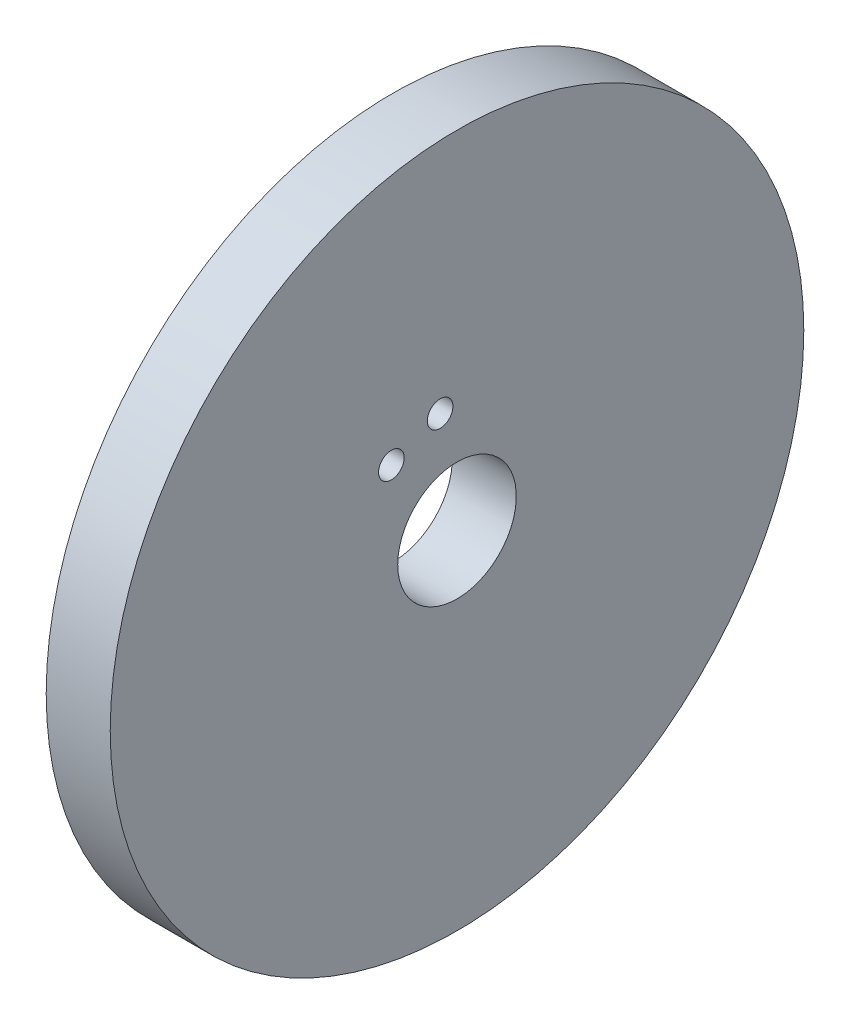
from build123d import *

# Parameters (mm, degrees)
AXIAL_PROFILE_MM_W     = 12
AXIAL_PROFILE_MM_H     = 53.8875
AXIAL_HOLES_DEPTH      = 96.448886845
AXIAL_HOLES_DEPTH_BACK = 96.448886845
SKETCH2_R              = 2.4
CUT_EXTRUDE2_START     = 13.7
SKETCH3_R              = 1.25
CUT_EXTRUDE2_DEPTH     = 7


with BuildPart() as part:
    # Axial profile (mm) → Full revolution (revolve)
    with BuildSketch(Plane.XY, mode=Mode.PRIVATE) as full_revolution_sk:
        with Locations((19.7, 38.05625)):
            Rectangle(AXIAL_PROFILE_MM_W, AXIAL_PROFILE_MM_H)
    revolve(full_revolution_sk.sketch.rotate(Axis((-110, 0, 0), (1, 0, 0)), 90), axis=Axis((-110, 0, 0), (1, 0, 0)))

    # Sketch2 → Axial holes (cut, two sides: drawn at the far end of the back side and taken through both)
    with BuildSketch(Plane(origin=(0, 0, 0), x_dir=(0, 0, -1), z_dir=(1, 0, 0)).offset(-AXIAL_HOLES_DEPTH_BACK)):
        with Locations((-3.163812264, 20.557973926)):
            Circle(SKETCH2_R)
        with Locations((-12.299529665, 16.773835877)):
            Circle(SKETCH2_R)
    extrude(amount=AXIAL_HOLES_DEPTH + AXIAL_HOLES_DEPTH_BACK, mode=Mode.SUBTRACT)

    # Sketch3 → Cut-Extrude2 (cut)
    with BuildSketch(Plane(origin=(0, 0, 0), x_dir=(0, 0, -1), z_dir=(1, 0, 0)).offset(CUT_EXTRUDE2_START)):
        with Locations((-31.819805153, 31.819805153)):
            Circle(SKETCH3_R)
        with Locations((-31.819805153, -31.819805153)):
            Circle(SKETCH3_R)
        with Locations((31.819805153, -31.819805153)):
            Circle(SKETCH3_R)
        with Locations((31.819805153, 31.819805153)):
            Circle(SKETCH3_R)
    extrude(amount=CUT_EXTRUDE2_DEPTH, mode=Mode.SUBTRACT)


solid = part.part
